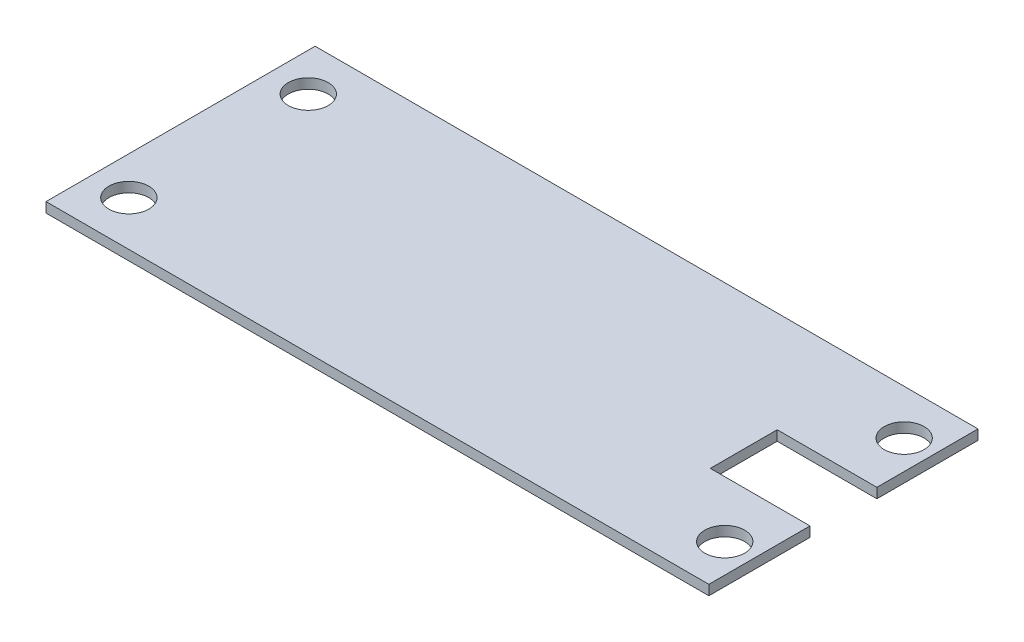
from build123d import *

# Parameters (mm, degrees)
SKETCH1_W               = 66.5
SKETCH1_H               = 27
BOSS_EXTRUDE1_DEPTH     = 1
CUT_EXTRUDE1_DEPTH      = 72.779175253
CUT_EXTRUDE1_DEPTH_BACK = 10
SKETCH2_W               = 6.707780704
SKETCH2_H               = 1
SKETCH3_R               = 2
CUT_EXTRUDE2_DEPTH      = 72.779175253


with BuildPart() as part:
    # Sketch1 → Boss-Extrude1 (new body)
    with BuildSketch(Plane(origin=(0, 0, 0), x_dir=(1, 0, 0), z_dir=(0, 1, 0))):
        with Locations((33.25, 13.5)):
            Rectangle(SKETCH1_W, SKETCH1_H)
    extrude(amount=BOSS_EXTRUDE1_DEPTH)

    # Sketch2 → Cut-Extrude1 (cut, two sides: drawn at the far end of the back side and taken through both)
    with BuildSketch(Plane(origin=(66.5, 0, 0), x_dir=(0, 0, -1), z_dir=(1, 0, 0)).offset(-CUT_EXTRUDE1_DEPTH_BACK)):
        with Locations((13.5, 0.5)):
            Rectangle(SKETCH2_W, SKETCH2_H)
    extrude(amount=CUT_EXTRUDE1_DEPTH + CUT_EXTRUDE1_DEPTH_BACK, mode=Mode.SUBTRACT)

    # Sketch3 → Cut-Extrude2 (cut, through all)
    with BuildSketch(Plane(origin=(0, 1, 0), x_dir=(1, 0, 0), z_dir=(0, 1, 0))):
        with Locations(Location((63.591245105, 4.5, 0), (0, 0, 270))):
            Circle(SKETCH3_R)
        with Locations(Location((63.591245105, 22.5, 0), (0, 0, 270))):
            Circle(SKETCH3_R)
        with Locations(Location((3.812777096, 22.5, 0), (0, 0, 270))):
            Circle(SKETCH3_R)
        with Locations(Location((3.812777096, 4.5, 0), (0, 0, 270))):
            Circle(SKETCH3_R)
    extrude(amount=-CUT_EXTRUDE2_DEPTH, mode=Mode.SUBTRACT)


solid = part.part
